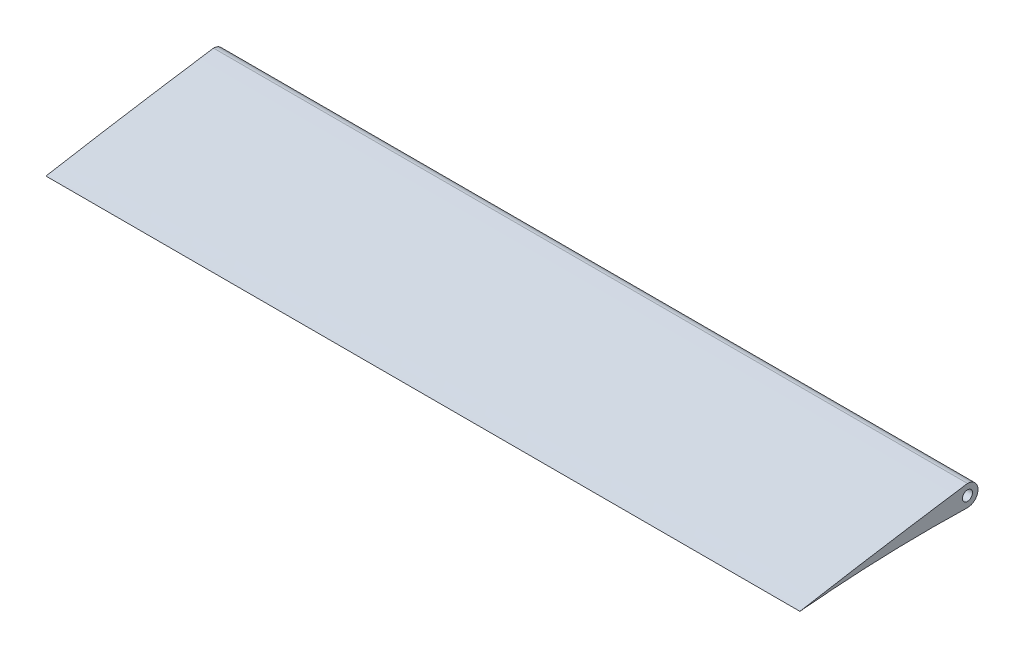
from build123d import *

# Parameters (mm, degrees)
SCHIZZO1_R      = 1.5
CORPOFOAM_DEPTH = 225


with BuildPart() as part:
    # Schizzo1 → CorpoFoam (new body)
    with BuildSketch(Plane(origin=(0, 0, 0), x_dir=(0, 0, -1), z_dir=(1, 0, 0))):
        with BuildLine():
            ThreePointArc((-200, 8.059305289), (-196.8581753, 4.91748059), (-200, 1.77565589))
            add(Edge.make_bspline(
                [(-200, 8.059305289), (-202.187379866, 7.739758676), (-207.50572073, 6.94925042), (-215.560350587, 5.731221771), (-223.977157043, 4.293295131), (-231.363413337, 3.181808879), (-237.746440905, 2.098942424), (-242.622069367, 1.245861924), (-246.644529334, 0.552864955), (-248.328398442, 0.246216773), (-250.427328459, -0.052966692), (-248.284955517, 0.172375667), (-246.518112421, 0.308690023), (-242.189387345, 0.685693601), (-236.806461265, 1.074101535), (-229.680385953, 1.497317245), (-221.184158699, 1.823218606), (-211.337618209, 1.967626103), (-204.130566759, 1.879296162), (-200.224163887, 1.781432917), (-200, 1.77565589)],
                knots=[0.90015767, 0.90015767, 0.90015767, 0.90015767, 0.913230871, 0.931955467, 0.948342069, 0.963693004, 0.976235918, 0.986320059, 0.993788799, 0.998424035, 1, 1.001588889, 1.006329218, 1.014202456, 1.025172808, 1.039173483, 1.056060631, 1.075578924, 1.097363607, 1.098689812, 1.098689812, 1.098689812, 1.098689812], degree=3))
        make_face()
        with Locations((-200, 4.91748059)):
            Circle(SCHIZZO1_R, mode=Mode.SUBTRACT)
    extrude(amount=CORPOFOAM_DEPTH)


solid = part.part
